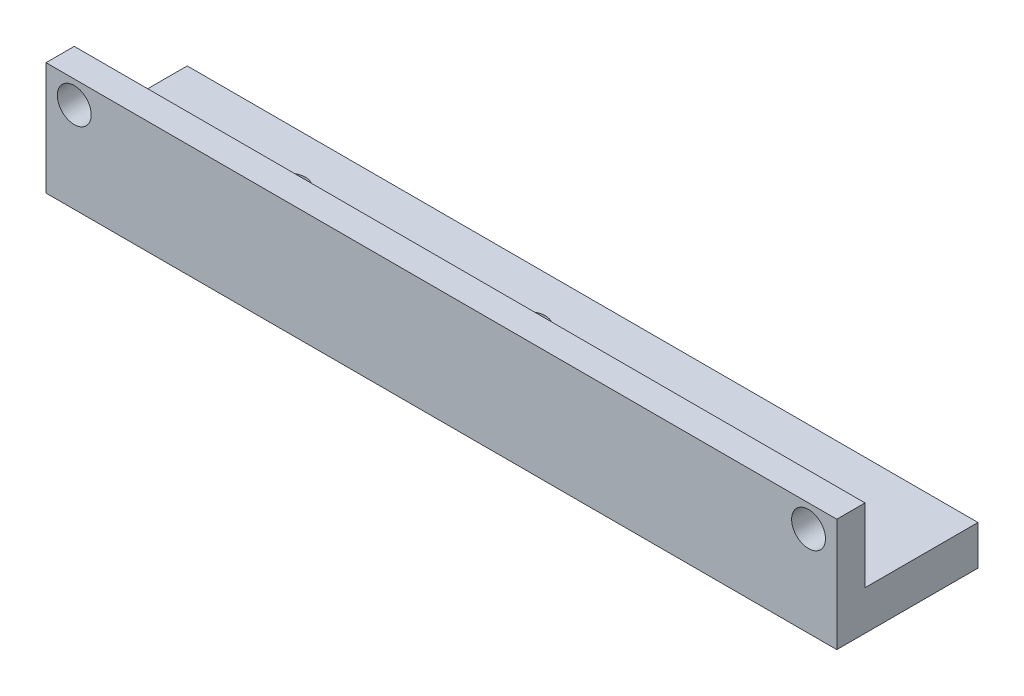
from build123d import *

# Parameters (mm, degrees)
SKETCH1_W               = 140
SKETCH1_H               = 25
BOSS_EXTRUDE1_DEPTH     = 20
SKETCH2_W               = 140
SKETCH2_H               = 20
CUT_EXTRUDE1_DEPTH      = 15
SKETCH3_R               = 3
CUT_EXTRUDE2_DEPTH      = 15
CUT_EXTRUDE3_DEPTH      = 144.003496461
CUT_EXTRUDE3_DEPTH_BACK = 144.003496461
SKETCH4_R               = 3
SKETCH5_W               = 140
SKETCH5_H               = 2
CUT_EXTRUDE4_DEPTH      = 15
SKETCH7_W               = 140
SKETCH7_H               = 25
BOSS_EXTRUDE2_DEPTH     = 2
SKETCH8_W               = 8
SKETCH8_H               = 5
CUT_EXTRUDE5_DEPTH      = 16
CUT_EXTRUDE6_DEPTH      = 143.807562825
CUT_EXTRUDE6_DEPTH_BACK = 143.807562825
SKETCH11_R              = 3


with BuildPart() as part:
    # Sketch1 → Boss-Extrude1 (new body)
    with BuildSketch(Plane(origin=(0, 0, 0), x_dir=(1, 0, 0), z_dir=(0, 1, 0))):
        with Locations((70, 12.5)):
            Rectangle(SKETCH1_W, SKETCH1_H)
    extrude(amount=BOSS_EXTRUDE1_DEPTH)

    # Sketch2 → Cut-Extrude1 (cut)
    with BuildSketch(Plane(origin=(0, 20, 0), x_dir=(1, 0, 0), z_dir=(0, 1, 0))):
        with Locations((70, 15)):
            Rectangle(SKETCH2_W, SKETCH2_H)
    extrude(amount=-CUT_EXTRUDE1_DEPTH, mode=Mode.SUBTRACT)

    # Sketch3 → Cut-Extrude2 (cut)
    with BuildSketch(Plane.XY):
        with Locations((5, 14)):
            Circle(SKETCH3_R)
        with Locations((135, 14)):
            Circle(SKETCH3_R)
    extrude(amount=-CUT_EXTRUDE2_DEPTH, mode=Mode.SUBTRACT)

    # Sketch4 → Cut-Extrude3 (cut, two sides: drawn at the far end of the back side and taken through both)
    with BuildSketch(Plane(origin=(0, 5, 0), x_dir=(1, 0, 0), z_dir=(0, 1, 0)).offset(-CUT_EXTRUDE3_DEPTH_BACK)):
        with Locations(Location((70, 15.4, 0), (0, 0, 270))):
            Circle(SKETCH4_R)
        with Locations(Location((27.5, 15.4, 0), (0, 0, 270))):
            Circle(SKETCH4_R)
    extrude(amount=CUT_EXTRUDE3_DEPTH + CUT_EXTRUDE3_DEPTH_BACK, mode=Mode.SUBTRACT)

    # Sketch5 → Cut-Extrude4 (cut)
    with BuildSketch(Plane(origin=(0, 0, -5), x_dir=(-1, 0, 0), z_dir=(0, 0, -1))):
        with Locations((-70, 19)):
            Rectangle(SKETCH5_W, SKETCH5_H)
    extrude(amount=-CUT_EXTRUDE4_DEPTH, mode=Mode.SUBTRACT)

    # Sketch7 → Boss-Extrude2 (add)
    with BuildSketch(Plane.XZ):
        with Locations((70, -12.5)):
            Rectangle(SKETCH7_W, SKETCH7_H)
    extrude(amount=BOSS_EXTRUDE2_DEPTH)

    # Sketch8 → Cut-Extrude5 (cut)
    with BuildSketch(Plane(origin=(0, 0, -25), x_dir=(-1, 0, 0), z_dir=(0, 0, -1))):
        with Locations((-70, 1.5)):
            Rectangle(SKETCH8_W, SKETCH8_H)
        with Locations((-27.5, 1.5)):
            Rectangle(SKETCH8_W, SKETCH8_H)
    extrude(amount=-CUT_EXTRUDE5_DEPTH, mode=Mode.SUBTRACT)

    # Sketch11 → Cut-Extrude6 (cut, two sides: drawn at the far end of the back side and taken through both)
    with BuildSketch(Plane(origin=(0, 5, 0), x_dir=(1, 0, 0), z_dir=(0, 1, 0)).offset(-CUT_EXTRUDE6_DEPTH_BACK)):
        with Locations(Location((27.5, 15.4, 0), (0, 0, 270))):
            Circle(SKETCH11_R)
        with Locations(Location((70, 15.4, 0), (0, 0, 270))):
            Circle(SKETCH11_R)
    extrude(amount=CUT_EXTRUDE6_DEPTH + CUT_EXTRUDE6_DEPTH_BACK, mode=Mode.SUBTRACT)


solid = part.part
